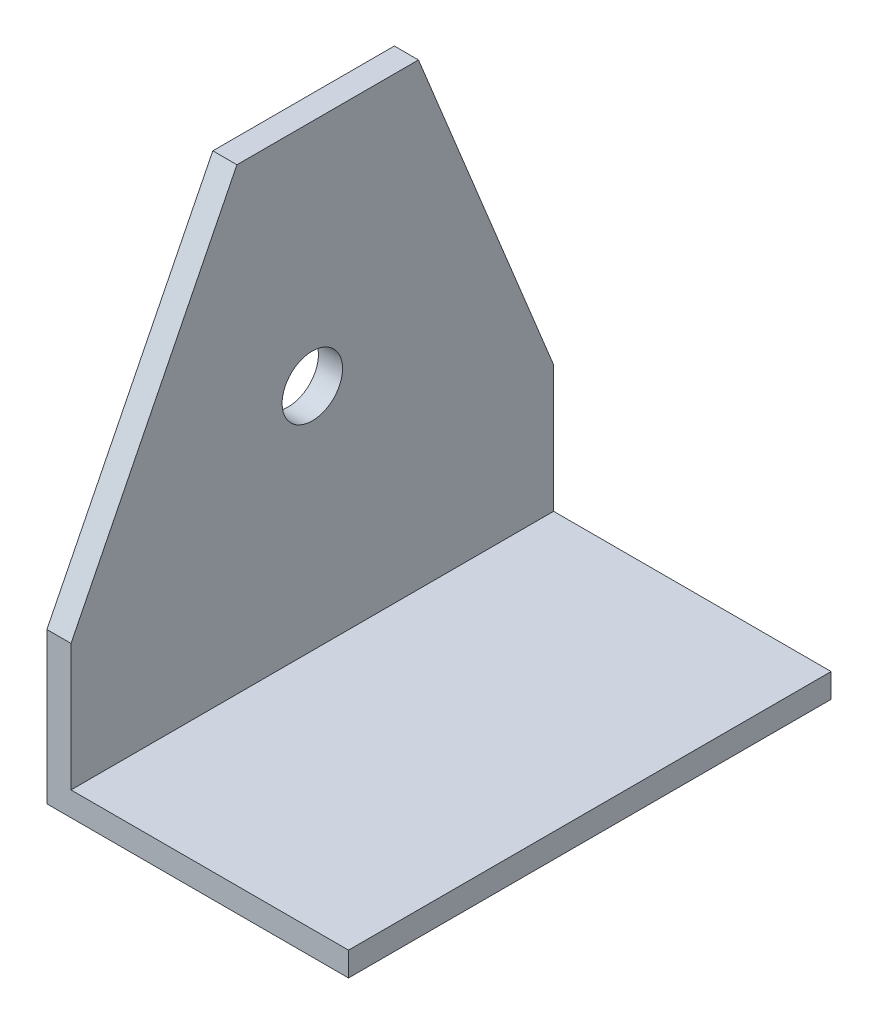
from build123d import *

# Parameters (mm, degrees)
BOSS_EXTRUDE1_DEPTH = 80
SKETCH2_R           = 5.0115
CUT_EXTRUDE1_DEPTH  = 80
CUT_EXTRUDE2_DEPTH  = 80


with BuildPart() as part:
    # Sketch1 → Boss-Extrude1 (new body)
    with BuildSketch(Plane.XY):
        Polygon((-42.913522538, 50.7), (-42.913522538, -29.3), (7.086477462, -29.3), (7.086477462, -25.3), (-38.913522538, -25.3), (-38.913522538, 50.7), align=None)
    extrude(amount=BOSS_EXTRUDE1_DEPTH)

    # Sketch2 → Cut-Extrude1 (cut)
    with BuildSketch(Plane(origin=(-38.913522538, 0, 0), x_dir=(0, 0, -1), z_dir=(1, 0, 0))):
        with Locations(Location((-40, 12.7, 0), (0, 0, 90))):
            Circle(SKETCH2_R)
    extrude(amount=-CUT_EXTRUDE1_DEPTH, mode=Mode.SUBTRACT)

    # Sketch3 → Cut-Extrude2 (cut)
    with BuildSketch(Plane(origin=(0, 0, 0), x_dir=(0, 0, -1), z_dir=(1, 0, 0))):
        Polygon((-80, -4.267166785), (-52.498027081, 50.7), (-80, 50.7), align=None)
        Polygon((0, -4.267166785), (-22.400737376, 50.7), (0, 50.7), align=None)
    extrude(amount=-CUT_EXTRUDE2_DEPTH, mode=Mode.SUBTRACT)


solid = part.part
